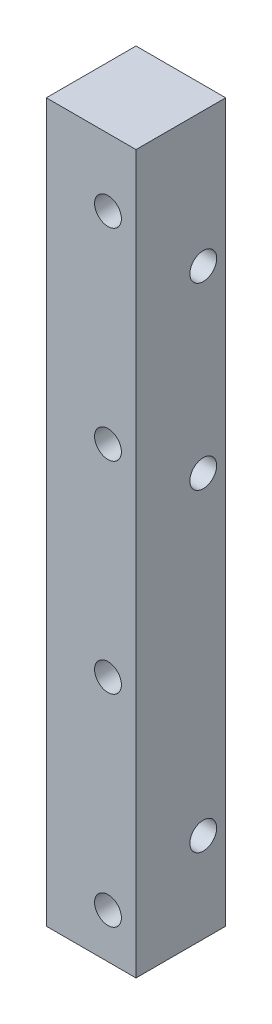
from build123d import *

# Parameters (mm, degrees)
SKETCH1_W                  = 12.7
SKETCH1_H                  = 12.7
BOSS_EXTRUDE1_DEPTH        = 101.6
TAP_DRILL_FOR_10_24_TAP1_D = 3.7973
TAP_DRILL_FOR_10_24_TAP2_D = 3.7973


with BuildPart() as part:
    # Sketch1 → Boss-Extrude1 (new body)
    with BuildSketch(Plane(origin=(0, 0, 0), x_dir=(1, 0, 0), z_dir=(0, 1, 0))):
        Rectangle(SKETCH1_W, SKETCH1_H)
    extrude(amount=BOSS_EXTRUDE1_DEPTH)

    # Tap Drill for #10-24 Tap1 (through all)
    with Locations(Plane(origin=(6.35, 0, 0), x_dir=(0, 0, -1), z_dir=(1, 0, 0))):
        with Locations((3.175, 82.55), (3.175, 12.7), (3.175, 57.15)):
            Hole(TAP_DRILL_FOR_10_24_TAP1_D / 2)

    # Tap Drill for #10-24 Tap2 (through all)
    with Locations(Plane.XY.offset(6.35)):
        with Locations((2.38125, 92.075), (2.38125, 6.35), (2.38125, 34.925), (2.38125, 63.5)):
            Hole(TAP_DRILL_FOR_10_24_TAP2_D / 2)


solid = part.part
